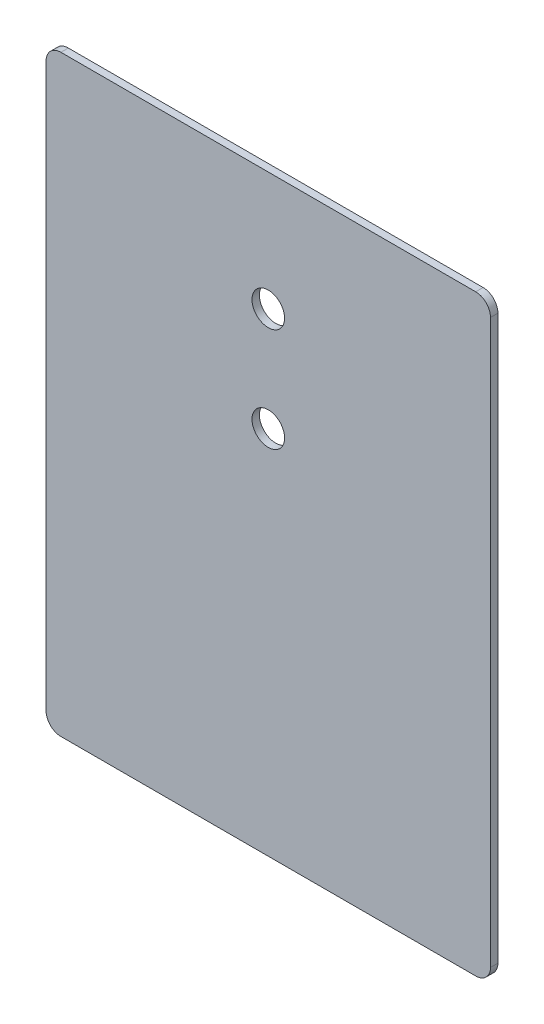
from build123d import *

# Parameters (mm, degrees)
SKETCH_1_W          = 300
SKETCH_1_H          = 400
EXTRUDE_1_DEPTH     = 5
FILLET_1_R          = 10
SKETCH_2_R          = 11
CUT_EXTRUDE_3_DEPTH = 5


with BuildPart() as part:
    # 草图1 → 凸台-拉伸1 (new body)
    with BuildSketch(Plane.XY):
        with Locations((-38.888888889, 84.044438104)):
            Rectangle(SKETCH_1_W, SKETCH_1_H)
    extrude(amount=EXTRUDE_1_DEPTH)

    # 圆角1
    fillet_1_edges = [part.edges().sort_by_distance(p)[0] for p in [
        (-188.888888889, 284.044438104, 2.5),
        (111.111111111, 284.044438104, 2.5),
        (111.111111111, -115.955561896, 2.5),
        (-188.888888889, -115.955561896, 2.5),
    ]]
    fillet(fillet_1_edges, radius=FILLET_1_R)

    # 草图2 → 切除-拉伸3 (cut)
    with BuildSketch(Plane.XY):
        with Locations((-38.888888889, 204.044438104)):
            Circle(SKETCH_2_R)
        with Locations((-38.888888889, 134.044438104)):
            Circle(SKETCH_2_R)
    extrude(amount=CUT_EXTRUDE_3_DEPTH, mode=Mode.SUBTRACT)


solid = part.part
